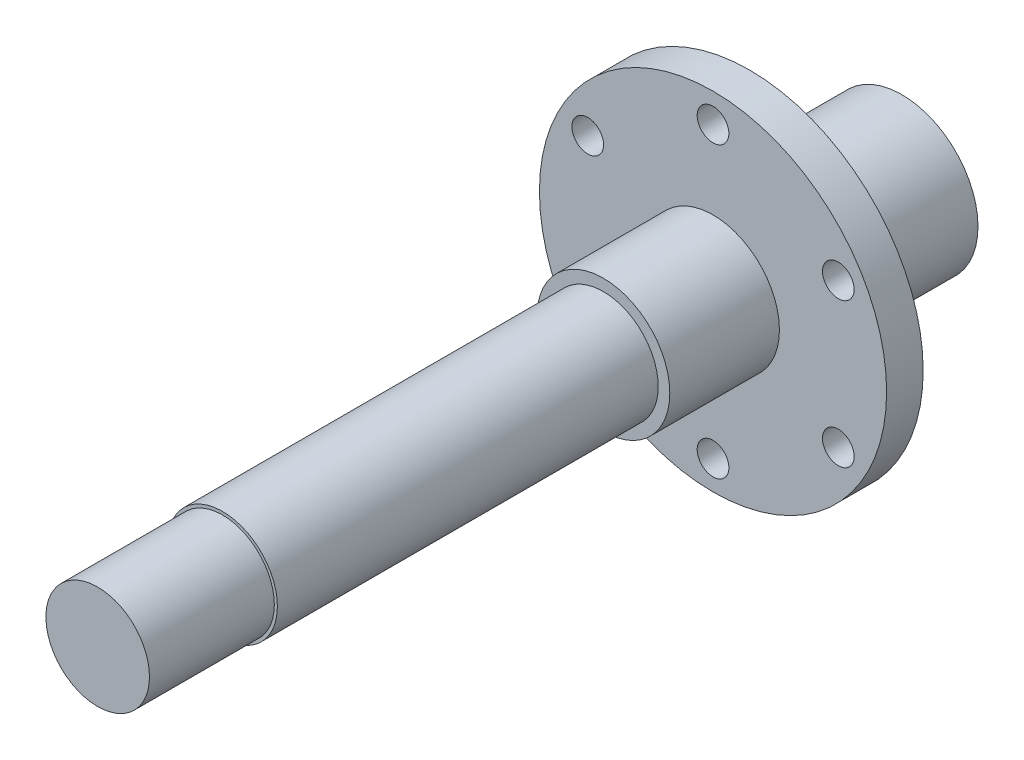
from build123d import *

# Parameters (mm, degrees)
SKETCH1_R           = 12.5
BOSS_EXTRUDE1_DEPTH = 25
SKETCH2_R           = 5
CUT_EXTRUDE1_DEPTH  = 20
SKETCH4_R           = 2
CUT_EXTRUDE2_DEPTH  = 20
SKETCH5_R           = 28.5
SKETCH5_R_2         = 2.6
BOSS_EXTRUDE2_DEPTH = 6
SKETCH6_R           = 9
BOSS_EXTRUDE3_DEPTH = 80.52
SKETCH7_R           = 8.5
BOSS_EXTRUDE4_DEPTH = 20.5
SKETCH8_R           = 10.9
BOSS_EXTRUDE5_DEPTH = 18


with BuildPart() as part:
    # Sketch1 → Boss-Extrude1 (new body)
    with BuildSketch(Plane.XY):
        Circle(SKETCH1_R)
    extrude(amount=BOSS_EXTRUDE1_DEPTH)

    # Sketch2 → Cut-Extrude1 (cut)
    with BuildSketch(Plane(origin=(0, 0, 0), x_dir=(-1, 0, 0), z_dir=(0, 0, -1))):
        Circle(SKETCH2_R)
    extrude(amount=-CUT_EXTRUDE1_DEPTH, mode=Mode.SUBTRACT)

    # Sketch4 → Cut-Extrude2 (cut)
    with BuildSketch(Plane(origin=(0, 0, 0), x_dir=(1, 0, 0), z_dir=(0, 1, 0))):
        with Locations(Location((0, -8, 0), (0, 0, 270))):
            Circle(SKETCH4_R)
    extrude(amount=-CUT_EXTRUDE2_DEPTH, mode=Mode.SUBTRACT)

    # Sketch5 → Boss-Extrude2 (add)
    with BuildSketch(Plane.XY.offset(25)):
        Circle(SKETCH5_R)
        with Locations((0, 23.75)):
            Circle(SKETCH5_R_2, mode=Mode.SUBTRACT)
        with Locations((20.56810334, 11.875)):
            Circle(SKETCH5_R_2, mode=Mode.SUBTRACT)
        with Locations((20.56810334, -11.875)):
            Circle(SKETCH5_R_2, mode=Mode.SUBTRACT)
        with Locations((0, -23.75)):
            Circle(SKETCH5_R_2, mode=Mode.SUBTRACT)
        with Locations((-20.56810334, -11.875)):
            Circle(SKETCH5_R_2, mode=Mode.SUBTRACT)
        with Locations((-20.56810334, 11.875)):
            Circle(SKETCH5_R_2, mode=Mode.SUBTRACT)
    extrude(amount=BOSS_EXTRUDE2_DEPTH)

    # Sketch6 → Boss-Extrude3 (add)
    with BuildSketch(Plane.XY.offset(31)):
        Circle(SKETCH6_R)
    extrude(amount=BOSS_EXTRUDE3_DEPTH)

    # Sketch7 → Boss-Extrude4 (add)
    with BuildSketch(Plane.XY.offset(111.52)):
        Circle(SKETCH7_R)
    extrude(amount=BOSS_EXTRUDE4_DEPTH)

    # Sketch8 → Boss-Extrude5 (add)
    with BuildSketch(Plane.XY.offset(31)):
        Circle(SKETCH8_R)
    extrude(amount=BOSS_EXTRUDE5_DEPTH)


solid = part.part
